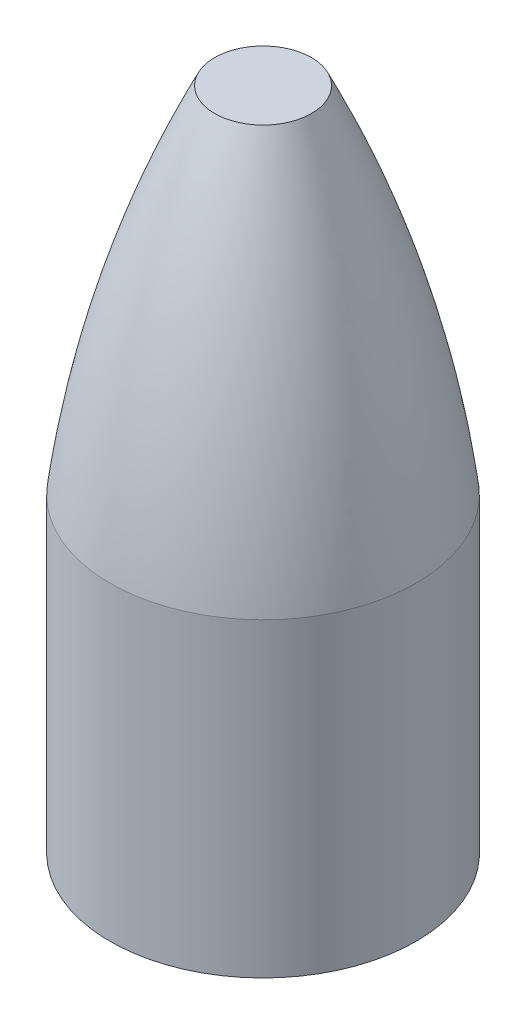
from build123d import *

# Parameters (mm, degrees)
SHELL1_T = -6.35


with BuildPart() as part:
    # Sketch1 → Revolve1 (revolve)
    with BuildSketch(Plane.XY, mode=Mode.PRIVATE) as revolve1_sk:
        with BuildLine():
            Line((0, 0), (-2286, 0))
            Line((-2286, 0), (-2286, 4634.23))
            add(Edge.make_bspline(
                [(-723.9, 9930.13), (-1132.191764896, 9076.796366633), (-1796.402272171, 7345.150835879), (-2174.472480212, 5529.823830383), (-2286, 4634.23)],
                knots=[0, 0, 0, 0, 0.511780428, 1, 1, 1, 1], degree=3))
            Line((-723.9, 9930.13), (0, 9930.13))
            Line((0, 9930.13), (0, 0))
        make_face()
    revolve(revolve1_sk.sketch.rotate(Axis((0, 0, 0), (0, 1, 0)), 270), axis=Axis((0, 0, 0), (0, 1, 0)))

    # Shell1
    shell1_openings = [part.faces().sort_by_distance(p)[0] for p in [
        (0, 0, 0),
    ]]
    offset(amount=SHELL1_T, openings=shell1_openings, kind=Kind.INTERSECTION)


solid = part.part
